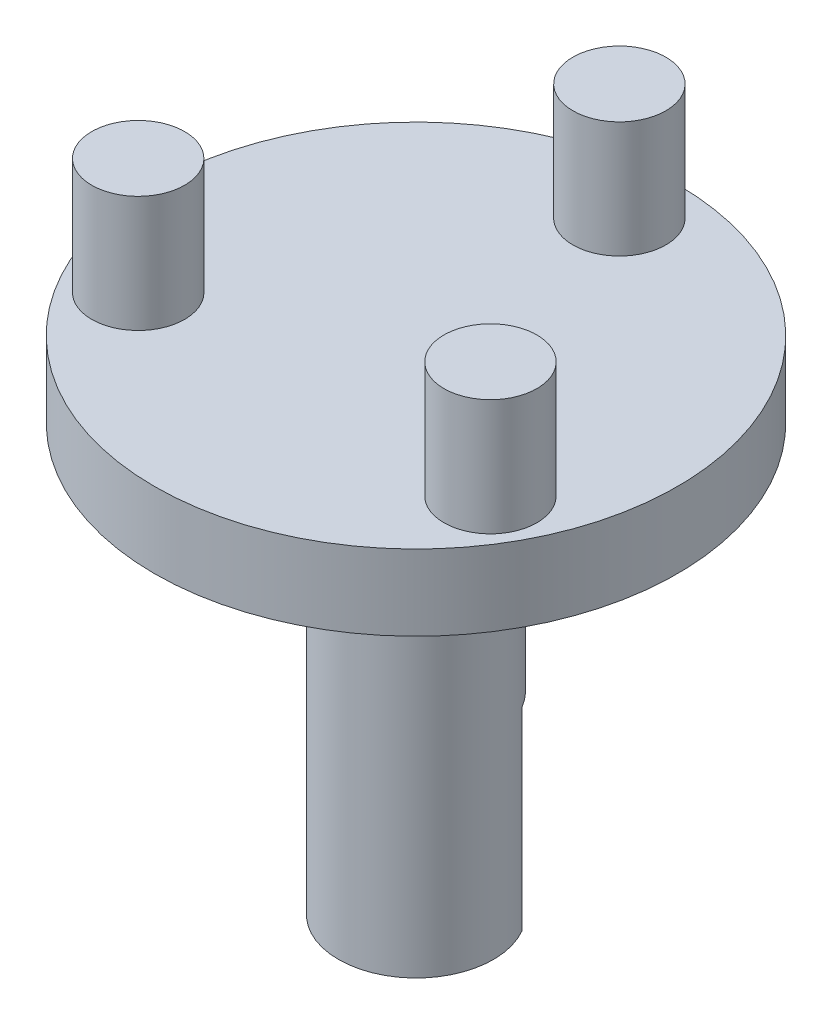
from build123d import *

# Parameters (mm, degrees)
SKETCH_1_R          = 13.5
EXTRUDE_1_DEPTH     = 3.9
SKETCH_2_R          = 2.4
EXTRUDE_2_DEPTH     = 6
SKETCH_3_R          = 4
EXTRUDE_3_DEPTH     = 7
SKETCH_4_R          = 5.5
EXTRUDE_4_DEPTH     = 1
SKETCH_5_R          = 4
EXTRUDE_5_DEPTH     = 15
CUT_EXTRUDE_START   = -10
CUT_EXTRUDE_1_DEPTH = 10
SKETCH_7_R          = 1.5
CUT_EXTRUDE_2_DEPTH = 1


with BuildPart() as part:
    # 草图1 → 凸台-拉伸1 (new body)
    with BuildSketch(Plane(origin=(0, 0, 0), x_dir=(1, 0, 0), z_dir=(0, 1, 0))):
        with Locations(Location((0, 0, 0), (0, 0, 270))):
            Circle(SKETCH_1_R)
    extrude(amount=EXTRUDE_1_DEPTH)

    # 草图2 → 凸台-拉伸2 (add)
    with BuildSketch(Plane(origin=(0, 3.9, 0), x_dir=(1, 0, 0), z_dir=(0, 1, 0))):
        with Locations(Location((0, 10.5, 0), (0, 0, 270))):
            Circle(SKETCH_2_R)
        with Locations(Location((9.09326674, -5.25, 0), (0, 0, 270))):
            Circle(SKETCH_2_R)
        with Locations(Location((-9.09326674, -5.25, 0), (0, 0, 270))):
            Circle(SKETCH_2_R)
    extrude(amount=EXTRUDE_2_DEPTH)

    # 草图3 → 凸台-拉伸3 (add)
    with BuildSketch(Plane.XZ):
        with Locations(Location((0, 0, 0), (0, 0, 270))):
            Circle(SKETCH_3_R)
    extrude(amount=EXTRUDE_3_DEPTH)

    # 草图4 → 凸台-拉伸4 (add)
    with BuildSketch(Plane.XZ):
        with Locations(Location((0, 0, 0), (0, 0, 90))):
            Circle(SKETCH_4_R)
    extrude(amount=EXTRUDE_4_DEPTH)

    # 草图5 → 凸台-拉伸5 (add)
    with BuildSketch(Plane.XZ.offset(7)):
        with Locations(Location((0, 0, 0), (0, 0, 270))):
            Circle(SKETCH_5_R)
    extrude(amount=EXTRUDE_5_DEPTH)

    # 草图6 → 切除-拉伸1 (cut)
    with BuildSketch(Plane.XZ.offset(22).offset(CUT_EXTRUDE_START)):
        with BuildLine():
            Line((3.464101615, -2), (-3.464101615, -2))
            ThreePointArc((-3.464101615, -2), (0, -4), (3.464101615, -2))
        make_face()
    extrude(amount=CUT_EXTRUDE_1_DEPTH, mode=Mode.SUBTRACT)

    # 草图7 → 切除-拉伸2 (cut)
    with BuildSketch(Plane(origin=(0, 0, -2), x_dir=(-1, 0, 0), z_dir=(0, 0, -1))):
        with Locations((0, -15.5)):
            Circle(SKETCH_7_R)
    extrude(amount=-CUT_EXTRUDE_2_DEPTH, mode=Mode.SUBTRACT)


solid = part.part
